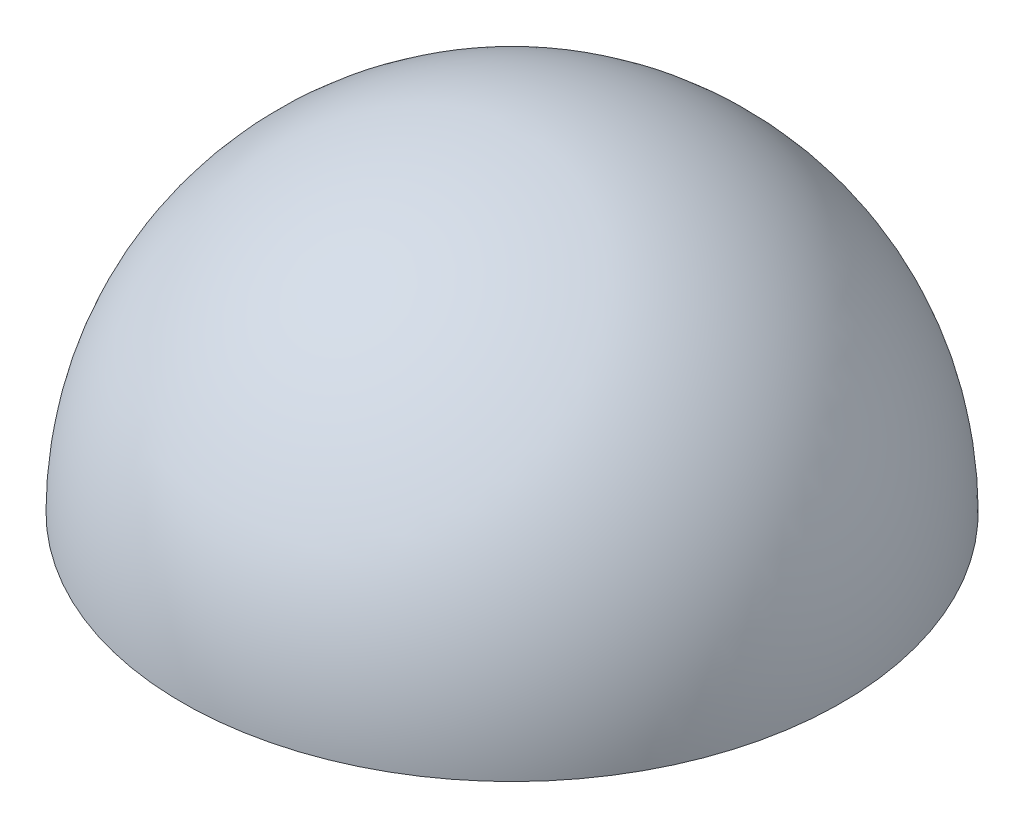
from build123d import *


with BuildPart() as part:
    # Sketch2 → Revolve1 (revolve)
    with BuildSketch(Plane(origin=(0, 0, 0), x_dir=(0, 1, 0), z_dir=(-1, 0, 0))):
        with BuildLine():
            Line((0, 0), (0, 45))
            ThreePointArc((0, 45), (31.819805153, 31.819805153), (45, 0))
            Line((45, 0), (0, 0))
        make_face()
    revolve(axis=Axis((0, 0, 0), (0, 1, 0)))


solid = part.part
